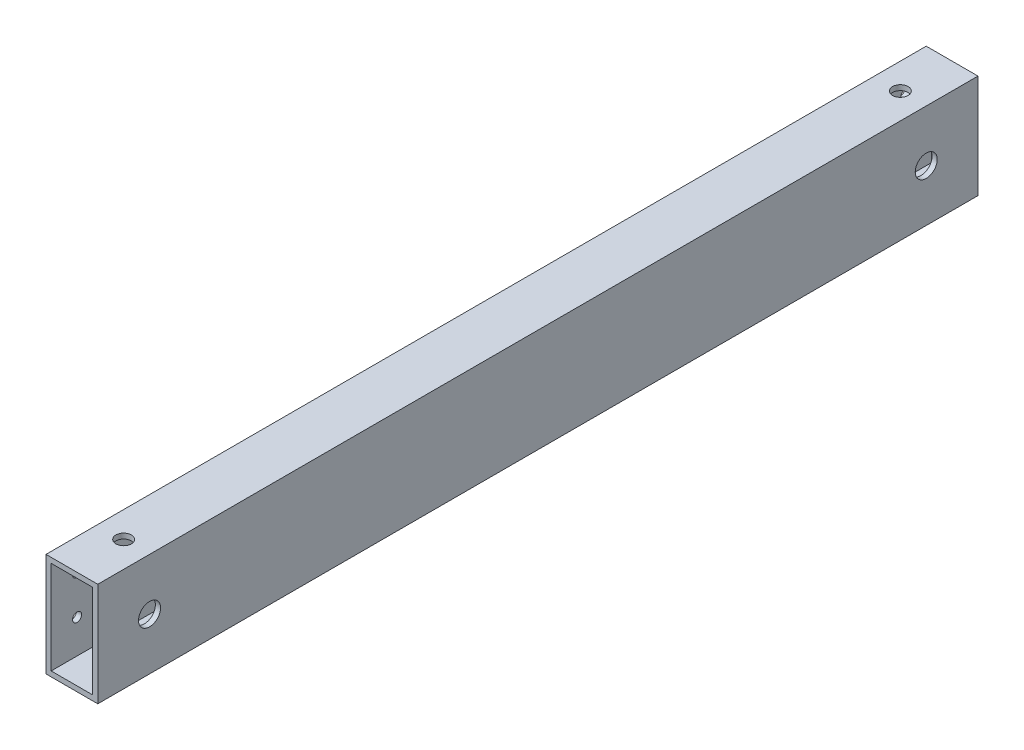
from build123d import *

# Parameters (mm, degrees)
ESBO_O1_W                = 20
ESBO_O1_H                = 40
ESBO_O1_W_2              = 16
ESBO_O1_H_2              = 36
RESSALTO_EXTRUS_O1_DEPTH = 340
ESBO_O2_R                = 1.75
CORTE_EXTRUS_O1_DEPTH    = 2
ESBO_O3_R                = 3
CORTE_EXTRUS_O2_DEPTH    = 2
ESBO_O4_R                = 4.25
CORTE_EXTRUS_O3_DEPTH    = 2


with BuildPart() as part:
    # Esboço1 → Ressalto-extrusão1 (new body)
    with BuildSketch(Plane.XY):
        with Locations((10, 20)):
            Rectangle(ESBO_O1_W, ESBO_O1_H)
        with Locations((10, 20)):
            Rectangle(ESBO_O1_W_2, ESBO_O1_H_2, mode=Mode.SUBTRACT)
    extrude(amount=RESSALTO_EXTRUS_O1_DEPTH)

    # Esboço2 → Corte-extrusão1 (cut)
    with BuildSketch(Plane.ZY):
        with Locations((10, 30)):
            Circle(ESBO_O2_R)
        with Locations((10, 15)):
            Circle(ESBO_O2_R)
        with Locations((70, 15)):
            Circle(ESBO_O2_R)
        with Locations((55, 15)):
            Circle(ESBO_O2_R)
        with Locations(Location((270, 15, 0), (0, 0, 180))):
            Circle(ESBO_O2_R)
        with Locations(Location((285, 15, 0), (0, 0, 180))):
            Circle(ESBO_O2_R)
        with Locations(Location((330, 15, 0), (0, 0, 180))):
            Circle(ESBO_O2_R)
        with Locations(Location((330, 30, 0), (0, 0, 180))):
            Circle(ESBO_O2_R)
    extrude(amount=-CORTE_EXTRUS_O1_DEPTH, mode=Mode.SUBTRACT)

    # Esboço3 → Corte-extrusão2 (cut)
    with BuildSketch(Plane(origin=(0, 40, 0), x_dir=(1, 0, 0), z_dir=(0, 1, 0))):
        with Locations(Location((10, -320, 0), (0, 0, 270))):
            Circle(ESBO_O3_R)
        with Locations(Location((10, -20, 0), (0, 0, 90))):
            Circle(ESBO_O3_R)
    extrude(amount=-CORTE_EXTRUS_O2_DEPTH, mode=Mode.SUBTRACT)

    # Esboço4 → Corte-extrusão3 (cut)
    with BuildSketch(Plane(origin=(20, 0, 0), x_dir=(0, 0, -1), z_dir=(1, 0, 0))):
        with Locations((-320, 20)):
            Circle(ESBO_O4_R)
        with Locations(Location((-20, 20, 0), (0, 0, 180))):
            Circle(ESBO_O4_R)
    extrude(amount=-CORTE_EXTRUS_O3_DEPTH, mode=Mode.SUBTRACT)


solid = part.part
